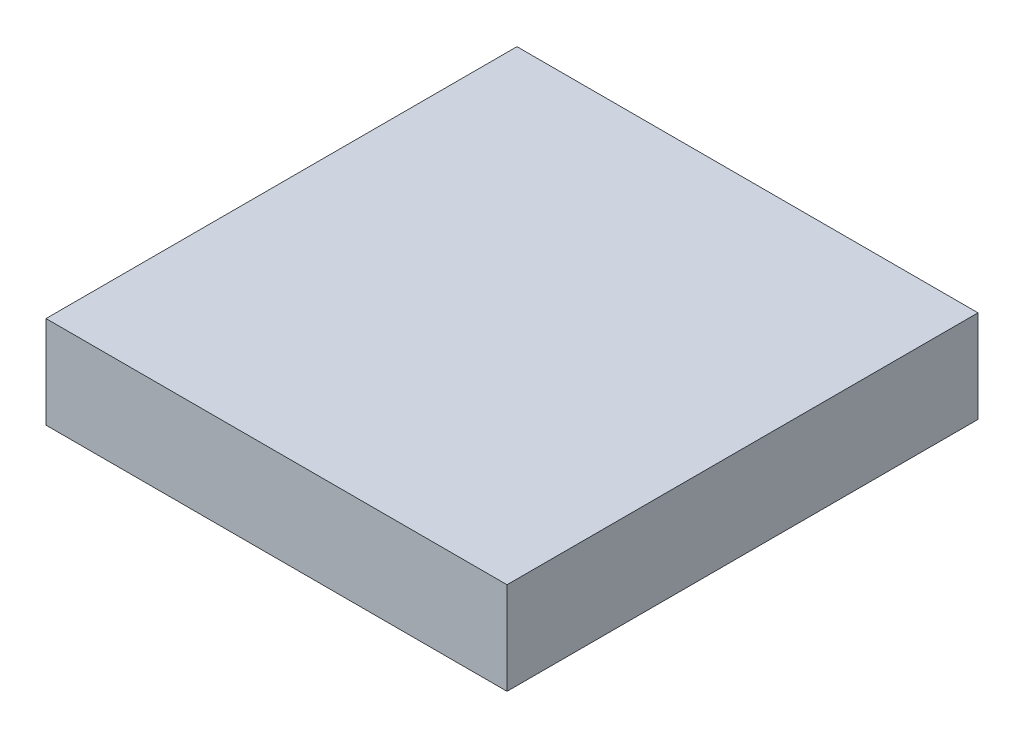
from build123d import *

# Parameters (mm, degrees)
SKETCH1_W           = 19.969788126
SKETCH1_H           = 20.4
BOSS_EXTRUDE1_DEPTH = 2


with BuildPart() as part:
    # Sketch1 → Boss-Extrude1 (new, symmetric)
    with BuildSketch(Plane(origin=(0, 0, 0), x_dir=(1, 0, 0), z_dir=(0, 1, 0))):
        with Locations((-50.515105937, 0)):
            Rectangle(SKETCH1_W, SKETCH1_H)
    extrude(amount=BOSS_EXTRUDE1_DEPTH, both=True)


solid = part.part
